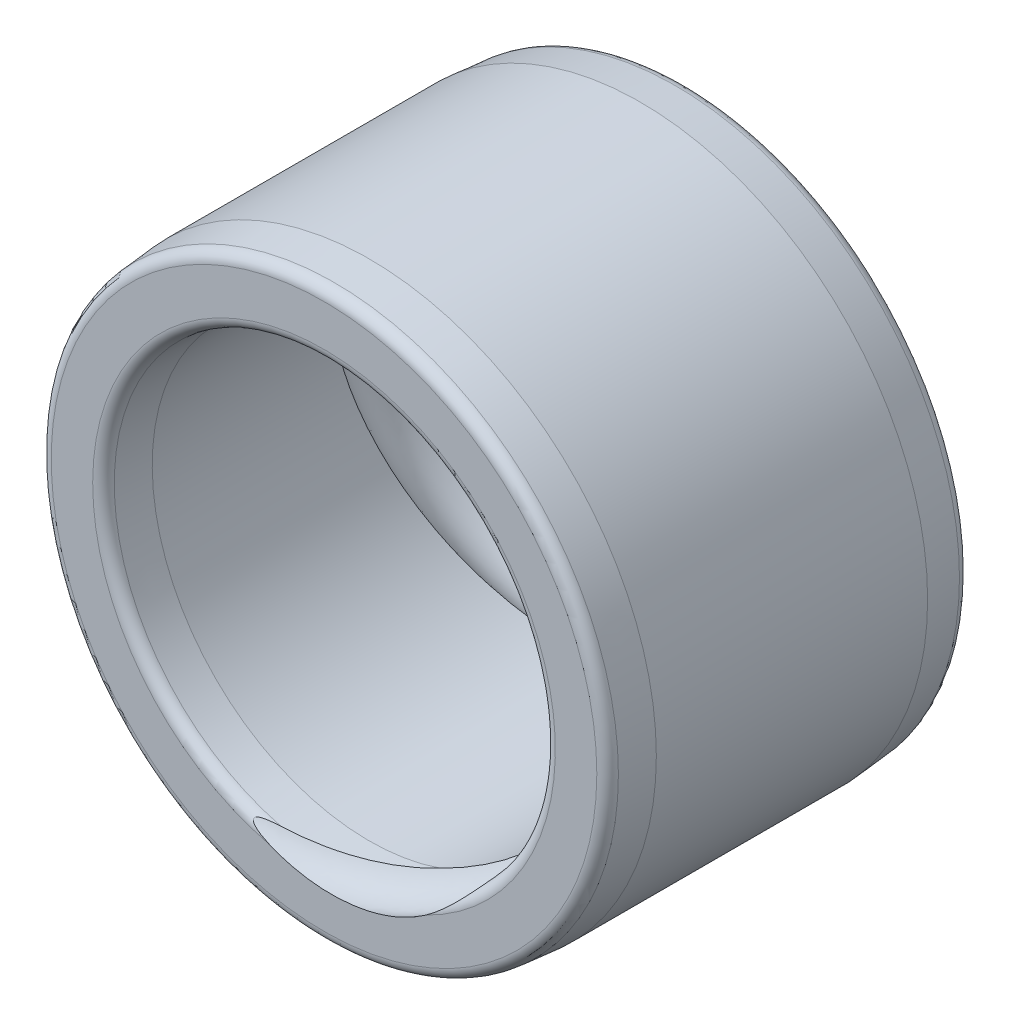
from build123d import *

# Parameters (mm, degrees)
CUT_SWEEP2_PITCH       = 16
CUT_SWEEP2_HEIGHT      = 20
CUT_SWEEP2_RADIUS      = 9
CUT_SWEEP2_START_ANGLE = -40
CUT_SWEEP2_PROFILE_R   = 1.5


with BuildPart() as part:
    # Sketch1 → Revolve1 (revolve)
    with BuildSketch(Plane(origin=(0, 0, 0), x_dir=(0, 0, -1), z_dir=(1, 0, 0)), mode=Mode.PRIVATE) as revolve1_sk:
        with BuildLine():
            Line((0, 10.233142914), (0, 12.066857086))
            ThreePointArc((0, 12.066857086), (0.131361332, 12.40465219), (0.456422129, 12.564954435))
            Line((0.456422129, 12.564954435), (2, 12.7))
            Line((2, 12.7), (14, 12.7))
            Line((14, 12.7), (15.543577871, 12.564954435))
            ThreePointArc((15.543577871, 12.564954435), (15.868638668, 12.40465219), (16, 12.066857086))
            Line((16, 12.066857086), (16, 10.233142914))
            ThreePointArc((16, 10.233142914), (15.868638668, 9.89534781), (15.543577871, 9.735045565))
            Line((15.543577871, 9.735045565), (14, 9.6))
            Line((14, 9.6), (2, 9.6))
            Line((2, 9.6), (0.456422129, 9.735045565))
            ThreePointArc((0.456422129, 9.735045565), (0.131361332, 9.89534781), (0, 10.233142914))
        make_face()
    revolve(revolve1_sk.sketch.rotate(Axis((0, 0, 0), (0, 0, -1)), 90), axis=Axis((0, 0, 0), (0, 0, -1)))

    # Cut-Sweep2: sweep along a helix
    with BuildLine() as cut_sweep2_path:
        add(Helix(CUT_SWEEP2_PITCH, CUT_SWEEP2_HEIGHT, CUT_SWEEP2_RADIUS, center=(0, 0, 2.5), direction=(0, 0, -1), lefthand=True, mode=Mode.PRIVATE).rotate(Axis((0, 0, 2.5), (0, 0, -1)), CUT_SWEEP2_START_ANGLE))
    # Cut-Sweep2 profile (on start of the path) → Cut-Sweep2 (sweep, cut)
    with BuildSketch(Plane(origin=(-6.894399988, -5.785088487, 2.5), x_dir=(-0.766044443118879, -0.6427876096866574, 0), z_dir=(0.6185065608318021, -0.7371074159141587, -0.27225409383950105))):
        Circle(CUT_SWEEP2_PROFILE_R)
    sweep(path=cut_sweep2_path.line, is_frenet=True, mode=Mode.SUBTRACT)


solid = part.part
